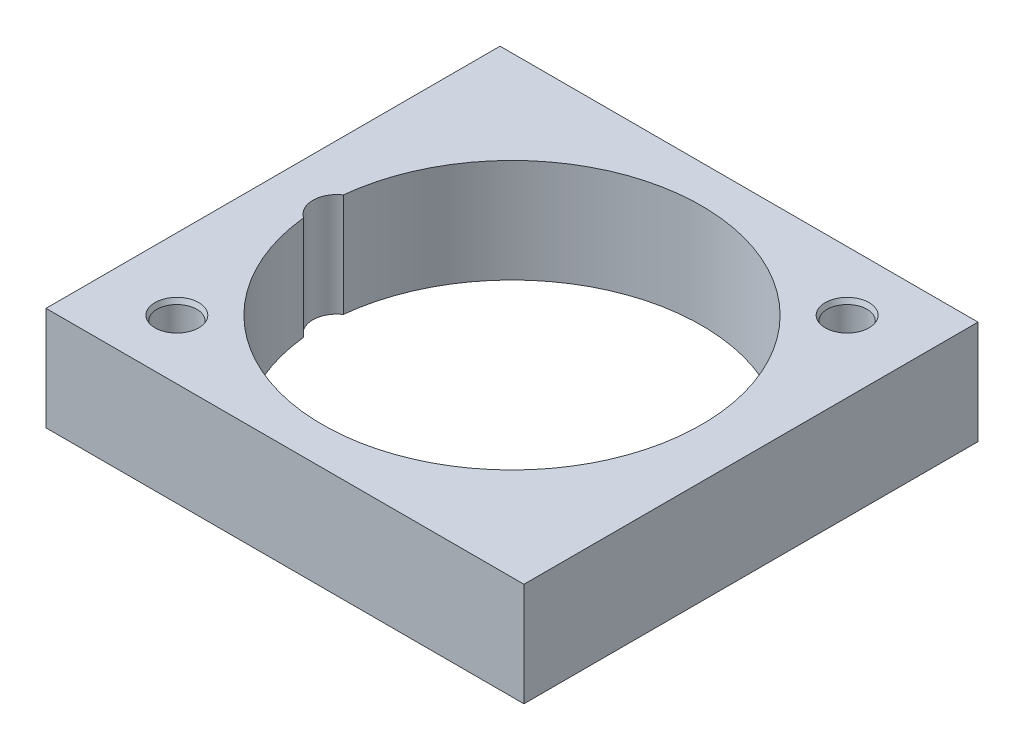
from build123d import *

# Parameters (mm, degrees)
ESQUISSE1_W                  = 60
ESQUISSE1_H                  = 57
BASE_EXTRUSION_DEPTH         = 13
R_P_TITION_CIRCULAIRE1_COUNT = 2


with BuildPart() as part:
    # Esquisse1 → Base-Extrusion (new body)
    with BuildSketch(Plane(origin=(0, 0, 0), x_dir=(1, 0, 0), z_dir=(0, 1, 0))):
        Rectangle(ESQUISSE1_W, ESQUISSE1_H)
        with BuildLine():
            ThreePointArc((-23.669090909, 2.492816788), (23.8, 0), (-23.669090909, -2.492816788))
            ThreePointArc((-23.669090909, -2.492816788), (-25, 0), (-23.669090909, 2.492816788))
        make_face(mode=Mode.SUBTRACT)
    extrude(amount=BASE_EXTRUSION_DEPTH)

    # Esquisse6 → Dégagement pour M51 (revolve, cut)
    with BuildSketch(Plane(origin=(21.03642674, 13, -21.03642674), x_dir=(0, 0, 1), z_dir=(1, 0, 0))):
        Polygon((0, 0), (0, 9.502151548), (2.5, 8), (2.5, 0.603553391), (2.75, 0), align=None)
    d_gagement_pour_m51 = revolve(axis=Axis((21.03642674, 19.35, -21.03642674), (0, -1, 0)), mode=Mode.SUBTRACT)

    # Répétition circulaire1: Dégagement pour M51 ×2 about axis
    r_p_tition_circulaire1_axis = Axis((0, 63, 0), (0, -1, 0))
    for i in range(1, R_P_TITION_CIRCULAIRE1_COUNT):
        add(d_gagement_pour_m51.rotate(r_p_tition_circulaire1_axis, i * 360 / R_P_TITION_CIRCULAIRE1_COUNT), mode=Mode.SUBTRACT)


solid = part.part
